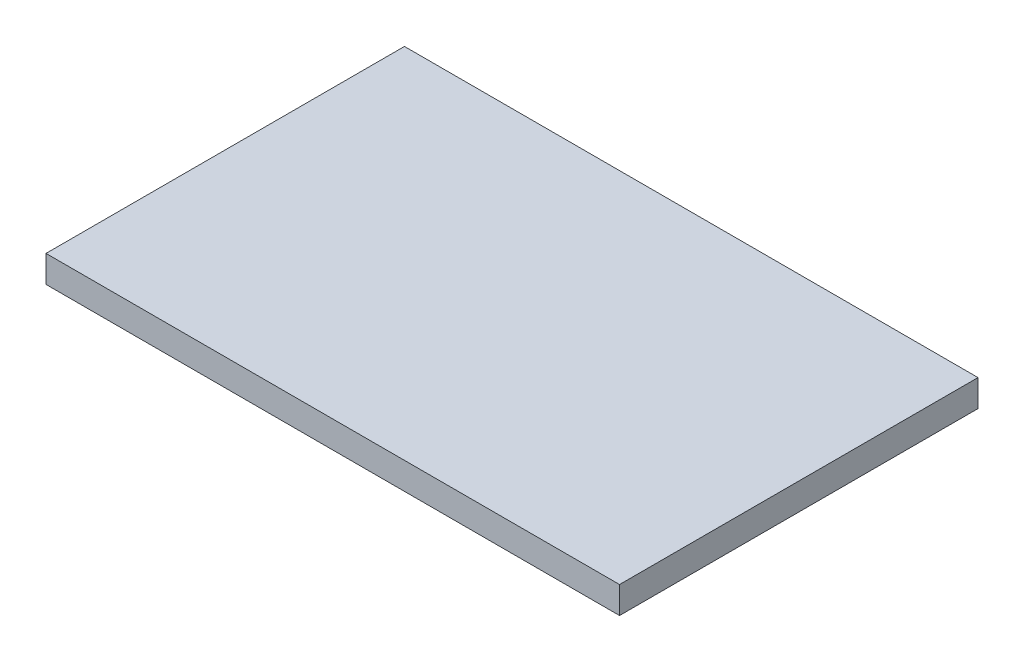
from build123d import *

# Parameters (mm, degrees)
SKETCH1_W           = 32
SKETCH1_H           = 1.5
BOSS_EXTRUDE1_DEPTH = 20


with BuildPart() as part:
    # Sketch1 → Boss-Extrude1 (new body)
    with BuildSketch(Plane.XY):
        Rectangle(SKETCH1_W, SKETCH1_H)
    extrude(amount=BOSS_EXTRUDE1_DEPTH)


solid = part.part
